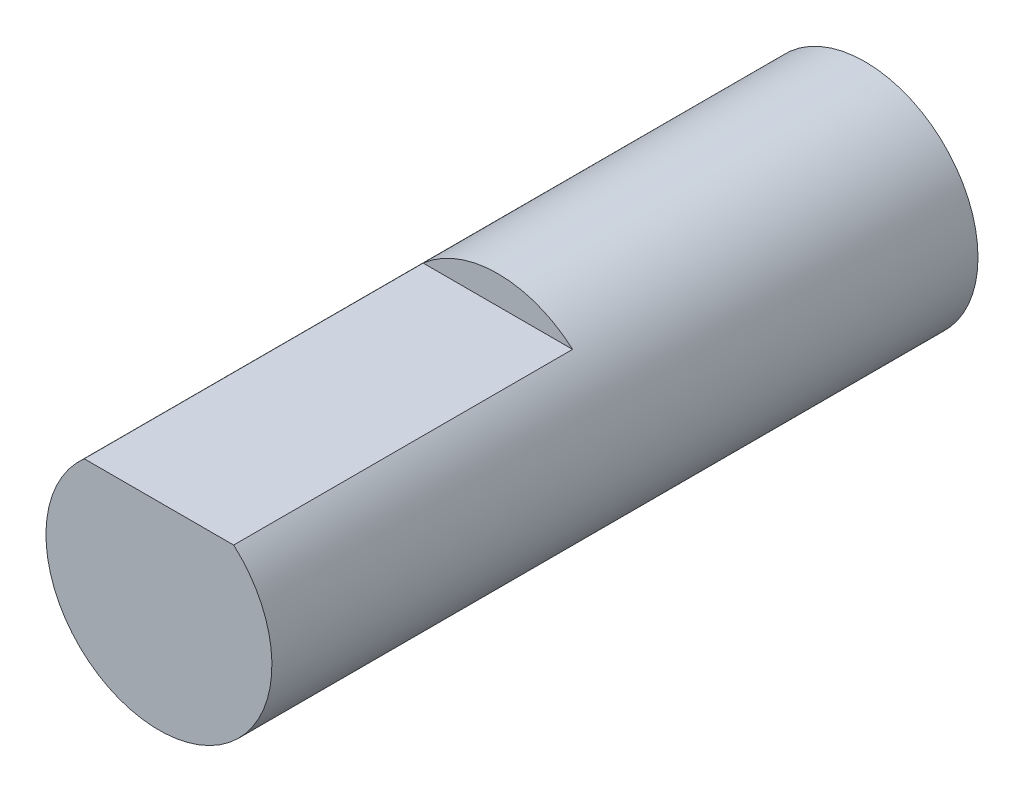
from build123d import *

# Parameters (mm, degrees)
SKETCH1_R           = 4
BOSS_EXTRUDE1_DEPTH = 25
CUT_EXTRUDE1_START  = -12
CUT_EXTRUDE1_DEPTH  = 12


with BuildPart() as part:
    # Sketch1 → Boss-Extrude1 (new body)
    with BuildSketch(Plane.XY):
        Circle(SKETCH1_R)
    extrude(amount=BOSS_EXTRUDE1_DEPTH)

    # Sketch2 → Cut-Extrude1 (cut)
    with BuildSketch(Plane.XY.offset(25).offset(CUT_EXTRUDE1_START)):
        with BuildLine():
            Line((-2.645751311, 3), (2.645751311, 3))
            ThreePointArc((2.645751311, 3), (0, 4), (-2.645751311, 3))
        make_face()
    extrude(amount=CUT_EXTRUDE1_DEPTH, mode=Mode.SUBTRACT)


solid = part.part
